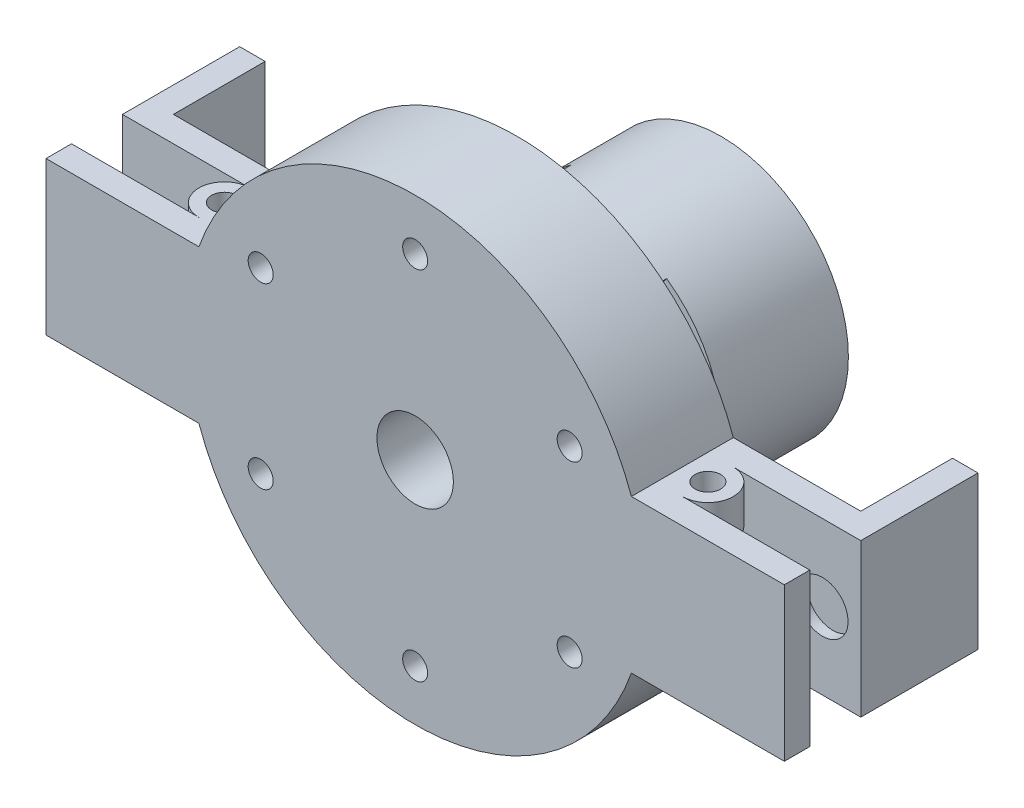
from build123d import *

# Parameters (mm, degrees)
IZIM1_R                     = 45
IZIM1_R_2                   = 2.45
Y_KSEKLIK_EKSTR_ZYON1_DEPTH = 20
IZIM2_R                     = 25
Y_KSEKLIK_EKSTR_ZYON2_DEPTH = 40
Y_KSEKLIK_EKSTR_ZYON3_START = -20
Y_KSEKLIK_EKSTR_ZYON3_DEPTH = 20
IZIM4_R                     = 2.5
KES_EKSTR_ZYON1_DEPTH       = 30
IZIM5_W                     = 10
IZIM5_H                     = 15
KES_EKSTR_ZYON3_DEPTH       = 30
IZIM8_R                     = 5
KES_EKSTR_ZYON4_DEPTH       = 2
IZIM10_R                    = 7.5
KES_EKSTR_ZYON5_DEPTH       = 25
IZIM12_W                    = 5
IZIM12_H                    = 18
Y_KSEKLIK_EKSTR_ZYON4_DEPTH = 30
IZIM14_W                    = 10
IZIM14_H                    = 15
KES_EKSTR_ZYON6_DEPTH       = 30
IZIM16_R                    = 15
KES_EKSTR_ZYON8_DEPTH       = 35
KES_EKSTR_ZYON9_START       = -25
KES_EKSTR_ZYON9_DEPTH       = 10
KES_EKSTR_ZYON10_START      = -15
KES_EKSTR_ZYON10_DEPTH      = 10


with BuildPart() as part:
    # Çizim1 → Yükseklik-Ekstrüzyon1 (new body)
    with BuildSketch(Plane.XY):
        Circle(IZIM1_R)
        with Locations((0, 35)):
            Circle(IZIM1_R_2, mode=Mode.SUBTRACT)
        with Locations((30.310889132, 17.5)):
            Circle(IZIM1_R_2, mode=Mode.SUBTRACT)
        with Locations((30.310889132, -17.5)):
            Circle(IZIM1_R_2, mode=Mode.SUBTRACT)
        with Locations((0, -35)):
            Circle(IZIM1_R_2, mode=Mode.SUBTRACT)
        with Locations((-30.310889132, -17.5)):
            Circle(IZIM1_R_2, mode=Mode.SUBTRACT)
        with Locations((-30.310889132, 17.5)):
            Circle(IZIM1_R_2, mode=Mode.SUBTRACT)
    extrude(amount=Y_KSEKLIK_EKSTR_ZYON1_DEPTH)

    # Çizim2 → Yükseklik-Ekstrüzyon2 (add)
    with BuildSketch(Plane(origin=(0, 0, 0), x_dir=(-1, 0, 0), z_dir=(0, 0, -1))):
        with Locations(Location((0, 0, 0), (0, 0, 180))):
            Circle(IZIM2_R)
    extrude(amount=Y_KSEKLIK_EKSTR_ZYON2_DEPTH)

    # Çizim3 → Yükseklik-Ekstrüzyon3 (add)
    with BuildSketch(Plane.XY.offset(20).offset(Y_KSEKLIK_EKSTR_ZYON3_START)):
        with BuildLine():
            Line((42.426406871, -15), (72.426406871, -15))
            Line((72.426406871, -15), (72.426406871, 15))
            Line((72.426406871, 15), (42.426406871, 15))
            ThreePointArc((42.426406871, 15), (45, 0), (42.426406871, -15))
        make_face()
        with BuildLine():
            Line((-42.426406871, -15), (-72.426406871, -15))
            Line((-72.426406871, -15), (-72.426406871, 15))
            Line((-72.426406871, 15), (-42.426406871, 15))
            ThreePointArc((-42.426406871, 15), (-45, 0), (-42.426406871, -15))
        make_face()
    extrude(amount=Y_KSEKLIK_EKSTR_ZYON3_DEPTH)

    # Çizim4 → Kes-Ekstrüzyon1 (cut)
    with BuildSketch(Plane(origin=(0, 15, 0), x_dir=(1, 0, 0), z_dir=(0, 1, 0))):
        with Locations(Location((47.426406871, -10, 0), (0, 0, 180))):
            Circle(IZIM4_R)
        with Locations((-47.426406871, -10)):
            Circle(IZIM4_R)
        with BuildLine():
            Line((72.426406871, -5), (47.426406871, -5))
            ThreePointArc((47.426406871, -5), (52.426406871, -10), (47.426406871, -15))
            Line((47.426406871, -15), (72.426406871, -15))
            Line((72.426406871, -15), (72.426406871, -5))
        make_face()
        with BuildLine():
            Line((-72.426406871, -15), (-47.426406871, -15))
            ThreePointArc((-47.426406871, -15), (-52.426406871, -10), (-47.426406871, -5))
            Line((-47.426406871, -5), (-72.426406871, -5))
            Line((-72.426406871, -5), (-72.426406871, -15))
        make_face()
    extrude(amount=-KES_EKSTR_ZYON1_DEPTH, mode=Mode.SUBTRACT)

    # Çizim5 → Kes-Ekstrüzyon3 (cut)
    with BuildSketch(Plane(origin=(72.426406871, 0, 0), x_dir=(0, 0, -1), z_dir=(1, 0, 0))):
        with Locations((-10, 0)):
            Rectangle(IZIM5_W, IZIM5_H)
    extrude(amount=-KES_EKSTR_ZYON3_DEPTH, mode=Mode.SUBTRACT)

    # Çizim8 → Kes-Ekstrüzyon4 (cut)
    with BuildSketch(Plane.XY.offset(5)):
        with Locations((64.926406871, 0)):
            Circle(IZIM8_R)
        with Locations(Location((-64.926406871, 0, 0), (0, 0, 180))):
            Circle(IZIM8_R)
    extrude(amount=-KES_EKSTR_ZYON4_DEPTH, mode=Mode.SUBTRACT)

    # Çizim10 → Kes-Ekstrüzyon5 (cut)
    with BuildSketch(Plane.XY.offset(20)):
        Circle(IZIM10_R)
    extrude(amount=-KES_EKSTR_ZYON5_DEPTH, mode=Mode.SUBTRACT)

    # Çizim12 → Yükseklik-Ekstrüzyon4 (add)
    with BuildSketch(Plane(origin=(0, 15, 0), x_dir=(1, 0, 0), z_dir=(0, 1, 0))):
        with Locations((69.926406871, 9)):
            Rectangle(IZIM12_W, IZIM12_H)
        with Locations((-69.926406871, 9)):
            Rectangle(IZIM12_W, IZIM12_H)
    extrude(amount=-Y_KSEKLIK_EKSTR_ZYON4_DEPTH)

    # Çizim14 → Kes-Ekstrüzyon6 (cut)
    with BuildSketch(Plane.ZY.offset(72.426406871)):
        with Locations((10, 0)):
            Rectangle(IZIM14_W, IZIM14_H)
    extrude(amount=-KES_EKSTR_ZYON6_DEPTH, mode=Mode.SUBTRACT)

    # Çizim16 → Kes-Ekstrüzyon8 (cut)
    with BuildSketch(Plane(origin=(0, 0, -40), x_dir=(-1, 0, 0), z_dir=(0, 0, -1))):
        Circle(IZIM16_R)
    extrude(amount=-KES_EKSTR_ZYON8_DEPTH, mode=Mode.SUBTRACT)

    # Çizim17 → Kes-Ekstrüzyon9 (cut)
    with BuildSketch(Plane(origin=(0, 0, -40), x_dir=(-1, 0, 0), z_dir=(0, 0, -1)).offset(KES_EKSTR_ZYON9_START)):
        with BuildLine():
            Line((-25, 0), (-15, 0))
            ThreePointArc((-15, 0), (-13.305162498, 6.926229199), (-8.603646545, 12.287280664))
            Line((-8.603646545, 12.287280664), (-14.339410909, 20.478801107))
            ThreePointArc((-14.339410909, 20.478801107), (-22.175270829, 11.543715331), (-25, 0))
        make_face()
    extrude(amount=-KES_EKSTR_ZYON9_DEPTH, mode=Mode.SUBTRACT)

    # Çizim18 → Kes-Ekstrüzyon10 (cut)
    with BuildSketch(Plane(origin=(0, 0, -40), x_dir=(-1, 0, 0), z_dir=(0, 0, -1)).offset(KES_EKSTR_ZYON10_START)):
        with BuildLine():
            Line((8.603646545, 12.287280664), (14.339410909, 20.478801107))
            ThreePointArc((14.339410909, 20.478801107), (22.175270829, 11.543715331), (25, 0))
            Line((25, 0), (15, 0))
            ThreePointArc((15, 0), (13.305162498, 6.926229199), (8.603646545, 12.287280664))
        make_face()
    extrude(amount=-KES_EKSTR_ZYON10_DEPTH, mode=Mode.SUBTRACT)


solid = part.part
